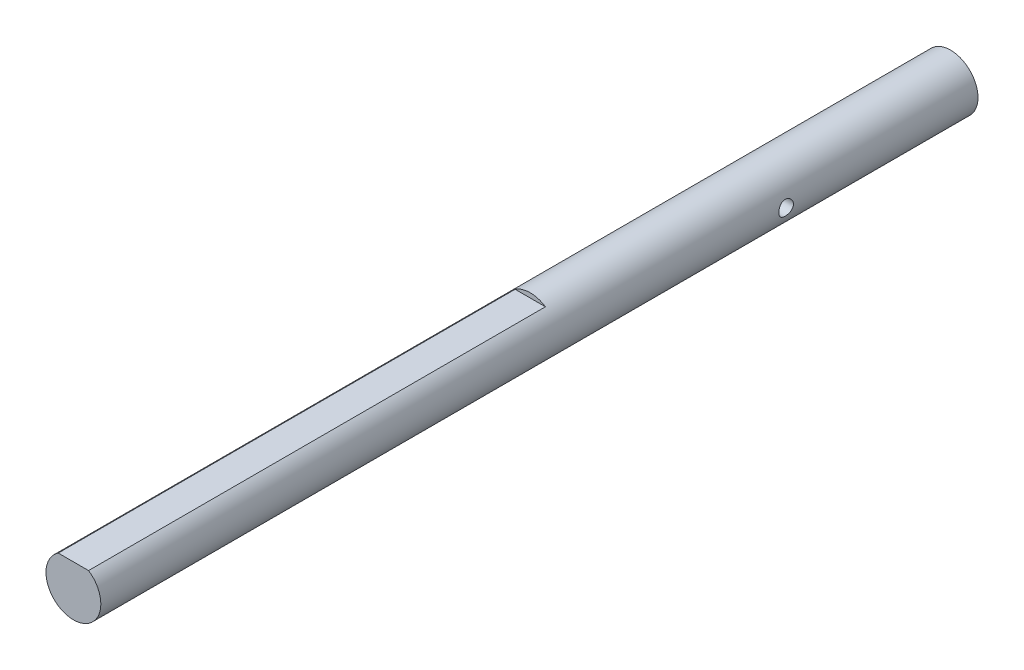
from build123d import *

# Parameters (mm, degrees)
SKETCH1_R               = 9.525
BOSS_EXTRUDE1_DEPTH     = 304.8
SKETCH3_W               = 23.44415324
SKETCH3_H               = 6.388604027
CUT_EXTRUDE1_DEPTH      = 158.75
CUT_EXTRUDE2_DEPTH      = 306.097511052
CUT_EXTRUDE2_DEPTH_BACK = 306.097511052
SKETCH8_R               = 2.54


with BuildPart() as part:
    # Sketch1 → Boss-Extrude1 (new body)
    with BuildSketch(Plane.XY):
        Circle(SKETCH1_R)
    extrude(amount=-BOSS_EXTRUDE1_DEPTH)

    # Sketch3 → Cut-Extrude1 (cut)
    with BuildSketch(Plane.XY):
        with Locations((0.072269276, 11.131802014)):
            Rectangle(SKETCH3_W, SKETCH3_H)
    extrude(amount=-CUT_EXTRUDE1_DEPTH, mode=Mode.SUBTRACT)

    # Sketch8 → Cut-Extrude2 (cut, two sides: drawn at the far end of the back side and taken through both)
    with BuildSketch(Plane(origin=(0, 0, 0), x_dir=(0, 0, -1), z_dir=(1, 0, 0)).offset(-CUT_EXTRUDE2_DEPTH_BACK)):
        with Locations((238.125, 0)):
            Circle(SKETCH8_R)
    extrude(amount=CUT_EXTRUDE2_DEPTH + CUT_EXTRUDE2_DEPTH_BACK, mode=Mode.SUBTRACT)


solid = part.part
